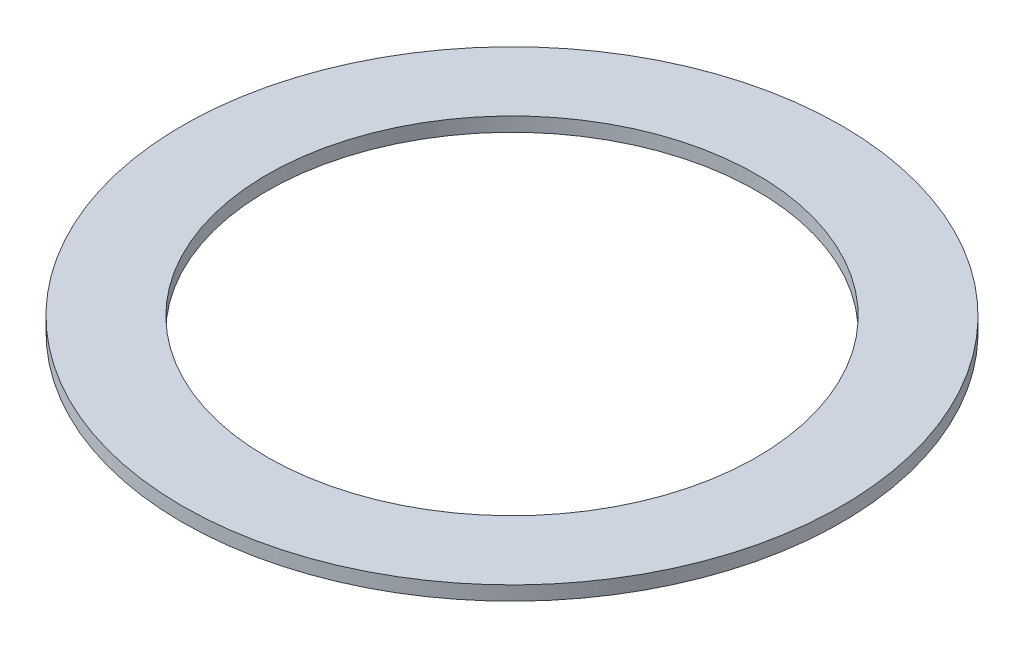
from build123d import *

# Parameters (mm, degrees)
SKETCH1_R           = 17.5
SKETCH1_R_2         = 13
BOSS_EXTRUDE1_DEPTH = 0.75


with BuildPart() as part:
    # Sketch1 → Boss-Extrude1 (new body)
    with BuildSketch(Plane(origin=(0, 0, 0), x_dir=(1, 0, 0), z_dir=(0, 1, 0))):
        with Locations(Location((0, 0, 0), (0, 0, 270))):
            Circle(SKETCH1_R)
        with Locations(Location((0, 0, 0), (0, 0, 270))):
            Circle(SKETCH1_R_2, mode=Mode.SUBTRACT)
    extrude(amount=BOSS_EXTRUDE1_DEPTH)


solid = part.part
